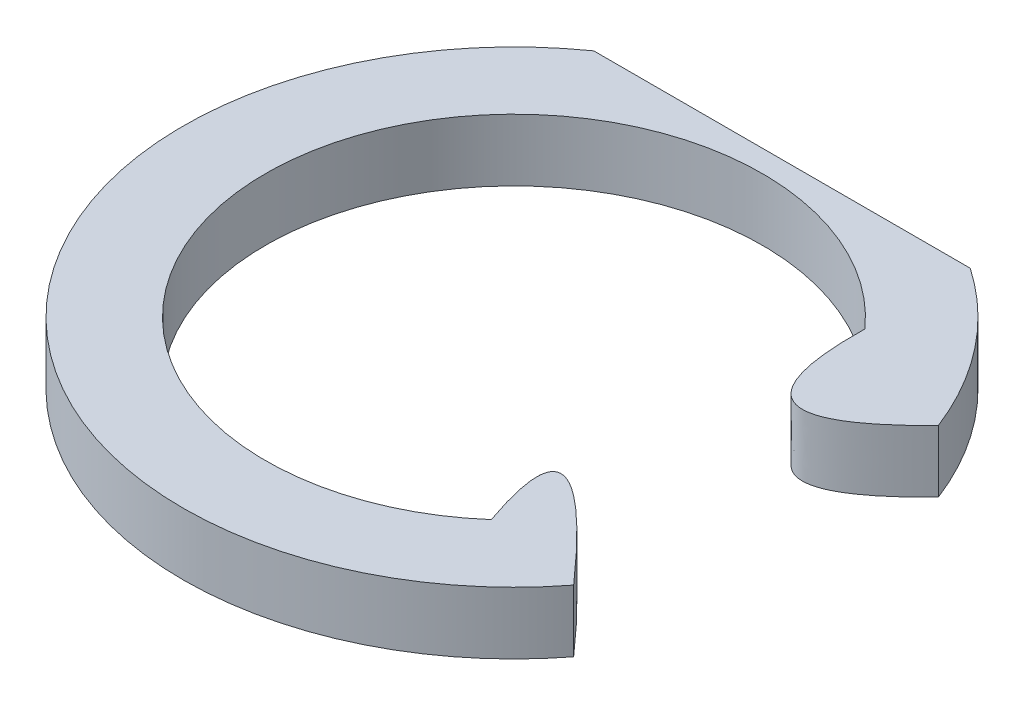
from build123d import *

# Parameters (mm, degrees)
BOSS_EXTRUDE6_DEPTH = 1.75


with BuildPart() as part:
    # Sketch2 → Boss-Extrude6 (new, symmetric)
    with BuildSketch(Plane(origin=(0, 0, 0), x_dir=(1, 0, 0), z_dir=(0, 1, 0))):
        with BuildLine():
            Line((-10.739531219, 15.234845975), (10.464592886, 15.234845975))
            ThreePointArc((10.464592886, 15.234845975), (14.498154651, 11.463496319), (17.237579405, 6.668889894))
            add(Edge.make_bspline(
                [(10.464592886, 9.300123426), (10.269158267, -0.534114199), (17.237579405, 6.668889894)],
                knots=[0, 0, 0, 1, 1, 1], degree=2))
            ThreePointArc((10.464592886, 9.300123426), (-13.973393874, 0.862707152), (9.241114219, -10.516739418))
            add(Edge.make_bspline(
                [(9.241114219, -10.516739418), (6.173157196, -1.690016533), (14.753630457, -11.391595632)],
                knots=[0, 0, 0, 1, 1, 1], degree=2))
            ThreePointArc((14.753630457, -11.391595632), (-13.463658356, -12.890615438), (-10.739531219, 15.234845975))
        make_face()
    extrude(amount=BOSS_EXTRUDE6_DEPTH, both=True)


solid = part.part
